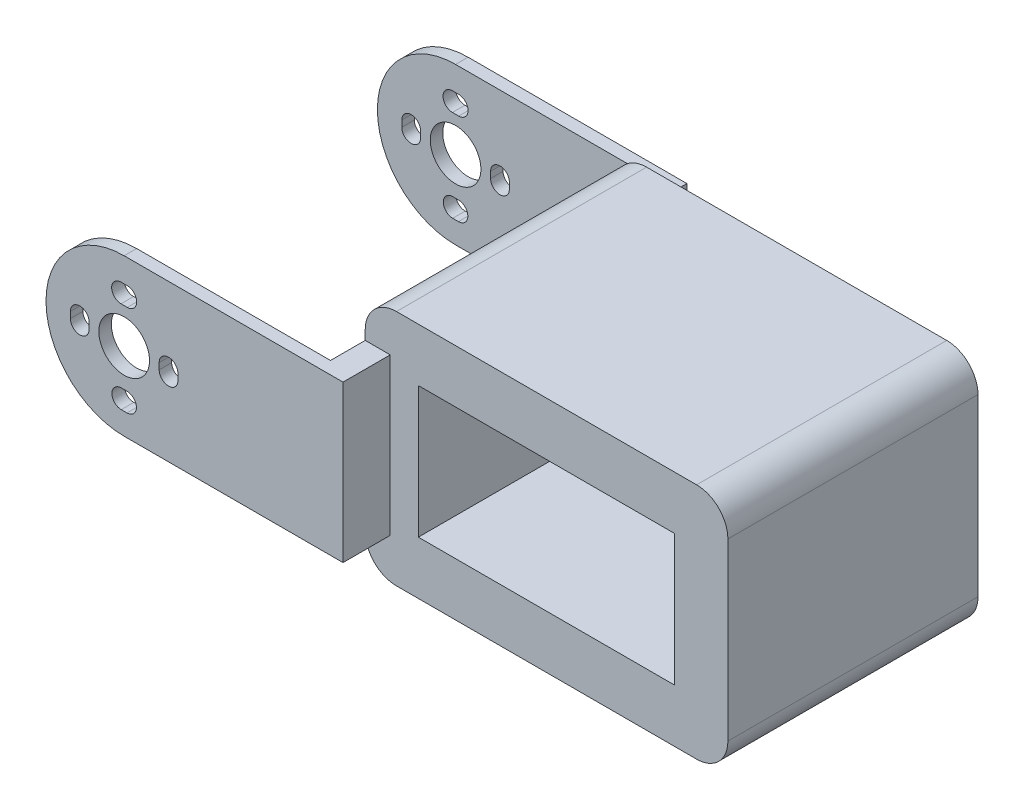
from build123d import *

# Parameters (mm, degrees)
SKETCH1_W           = 58
SKETCH1_H           = 38
SKETCH1_W_2         = 41
SKETCH1_H_2         = 21
BOSS_EXTRUDE1_DEPTH = 40
SKETCH2_W           = 4
SKETCH2_H           = 25
BOSS_EXTRUDE2_DEPTH = 5.55
SKETCH2_2_W         = 4
SKETCH2_2_H         = 25
BOSS_EXTRUDE3_DEPTH = 45.55
SKETCH3_R           = 4.05
BOSS_EXTRUDE6_DEPTH = 2
BOSS_EXTRUDE7_START = -53
SKETCH3_8_R         = 4.05
BOSS_EXTRUDE7_DEPTH = 53
CUT_EXTRUDE1_START  = -51
SKETCH3_11_R        = 4.05
CUT_EXTRUDE1_DEPTH  = 51
FILLET2_R           = 5
FILLET3_R           = 5
FILLET4_R           = 5
FILLET5_R           = 5


with BuildPart() as part:
    # Sketch1 → Boss-Extrude1 (new body)
    with BuildSketch(Plane.XY):
        with Locations((-0.095837804, -6.136072895)):
            Rectangle(SKETCH1_W, SKETCH1_H)
        with Locations((-0.095837804, -6.136072895)):
            Rectangle(SKETCH1_W_2, SKETCH1_H_2, mode=Mode.SUBTRACT)
    extrude(amount=BOSS_EXTRUDE1_DEPTH)

    # Sketch2 → Boss-Extrude2 (add)
    with BuildSketch(Plane.XY.offset(40)):
        with Locations((-27.095837804, -6.136072895)):
            Rectangle(SKETCH2_W, SKETCH2_H)
    extrude(amount=BOSS_EXTRUDE2_DEPTH)

    # Sketch2<2> → Boss-Extrude3 (add)
    with BuildSketch(Plane.XY.offset(40)):
        with Locations((-27.095837804, -6.136072895)):
            Rectangle(SKETCH2_2_W, SKETCH2_2_H)
    extrude(amount=-BOSS_EXTRUDE3_DEPTH)

    # Sketch3 → Boss-Extrude6 (add)
    with BuildSketch(Plane.XY.offset(45.55)):
        with BuildLine():
            Line((-25.095837804, -18.636072895), (-25.095837804, 6.363927105))
            Line((-25.095837804, 6.363927105), (-60.095837804, 6.363927105))
            ThreePointArc((-60.095837804, 6.363927105), (-72.595837804, -6.136072895), (-60.095837804, -18.636072895))
            Line((-60.095837804, -18.636072895), (-25.095837804, -18.636072895))
        make_face()
        with BuildLine():
            Line((-51.495837804, -5.636072895), (-51.495837804, -6.636072895))
            ThreePointArc((-51.495837804, -6.636072895), (-52.995837804, -8.136072895), (-54.495837804, -6.636072895))
            Line((-54.495837804, -6.636072895), (-54.495837804, -5.636072895))
            ThreePointArc((-54.495837804, -5.636072895), (-52.995837804, -4.136072895), (-51.495837804, -5.636072895))
        make_face(mode=Mode.SUBTRACT)
        with BuildLine():
            Line((-59.635749439, -15.176248856), (-60.555926168, -15.176248856))
            ThreePointArc((-60.555926168, -15.176248856), (-62.055926168, -13.676248856), (-60.555926168, -12.176248856))
            Line((-60.555926168, -12.176248856), (-59.635749439, -12.176248856))
            ThreePointArc((-59.635749439, -12.176248856), (-58.135749439, -13.676248856), (-59.635749439, -15.176248856))
        make_face(mode=Mode.SUBTRACT)
        with Locations((-60.095837804, -6.136072895)):
            Circle(SKETCH3_R, mode=Mode.SUBTRACT)
        with BuildLine():
            Line((-59.595837804, -0.536072895), (-60.595837804, -0.536072895))
            ThreePointArc((-60.595837804, -0.536072895), (-62.095837804, 0.963927105), (-60.595837804, 2.463927105))
            Line((-60.595837804, 2.463927105), (-59.595837804, 2.463927105))
            ThreePointArc((-59.595837804, 2.463927105), (-58.095837804, 0.963927105), (-59.595837804, -0.536072895))
        make_face(mode=Mode.SUBTRACT)
        with BuildLine():
            ThreePointArc((-68.695837804, -5.636072895), (-67.195837804, -4.136072895), (-65.695837804, -5.636072895))
            Line((-65.695837804, -5.636072895), (-65.695837804, -6.636072895))
            ThreePointArc((-65.695837804, -6.636072895), (-67.195837804, -8.136072895), (-68.695837804, -6.636072895))
            Line((-68.695837804, -6.636072895), (-68.695837804, -5.636072895))
        make_face(mode=Mode.SUBTRACT)
    extrude(amount=BOSS_EXTRUDE6_DEPTH)

    # Sketch3<8> → Boss-Extrude7 (add)
    with BuildSketch(Plane.XY.offset(45.55).offset(BOSS_EXTRUDE7_START)):
        with BuildLine():
            Line((-25.095837804, -18.636072895), (-25.095837804, 6.363927105))
            Line((-25.095837804, 6.363927105), (-60.095837804, 6.363927105))
            ThreePointArc((-60.095837804, 6.363927105), (-72.595837804, -6.136072895), (-60.095837804, -18.636072895))
            Line((-60.095837804, -18.636072895), (-25.095837804, -18.636072895))
        make_face()
        with BuildLine():
            Line((-51.495837804, -5.636072895), (-51.495837804, -6.636072895))
            ThreePointArc((-51.495837804, -6.636072895), (-52.995837804, -8.136072895), (-54.495837804, -6.636072895))
            Line((-54.495837804, -6.636072895), (-54.495837804, -5.636072895))
            ThreePointArc((-54.495837804, -5.636072895), (-52.995837804, -4.136072895), (-51.495837804, -5.636072895))
        make_face(mode=Mode.SUBTRACT)
        with BuildLine():
            Line((-59.635749439, -15.176248856), (-60.555926168, -15.176248856))
            ThreePointArc((-60.555926168, -15.176248856), (-62.055926168, -13.676248856), (-60.555926168, -12.176248856))
            Line((-60.555926168, -12.176248856), (-59.635749439, -12.176248856))
            ThreePointArc((-59.635749439, -12.176248856), (-58.135749439, -13.676248856), (-59.635749439, -15.176248856))
        make_face(mode=Mode.SUBTRACT)
        with Locations((-60.095837804, -6.136072895)):
            Circle(SKETCH3_8_R, mode=Mode.SUBTRACT)
        with BuildLine():
            Line((-59.595837804, -0.536072895), (-60.595837804, -0.536072895))
            ThreePointArc((-60.595837804, -0.536072895), (-62.095837804, 0.963927105), (-60.595837804, 2.463927105))
            Line((-60.595837804, 2.463927105), (-59.595837804, 2.463927105))
            ThreePointArc((-59.595837804, 2.463927105), (-58.095837804, 0.963927105), (-59.595837804, -0.536072895))
        make_face(mode=Mode.SUBTRACT)
        with BuildLine():
            ThreePointArc((-68.695837804, -5.636072895), (-67.195837804, -4.136072895), (-65.695837804, -5.636072895))
            Line((-65.695837804, -5.636072895), (-65.695837804, -6.636072895))
            ThreePointArc((-65.695837804, -6.636072895), (-67.195837804, -8.136072895), (-68.695837804, -6.636072895))
            Line((-68.695837804, -6.636072895), (-68.695837804, -5.636072895))
        make_face(mode=Mode.SUBTRACT)
    extrude(amount=BOSS_EXTRUDE7_DEPTH)

    # Sketch3<11> → Cut-Extrude1 (cut)
    with BuildSketch(Plane.XY.offset(45.55).offset(CUT_EXTRUDE1_START)):
        with BuildLine():
            Line((-29.095837804, -18.636072895), (-29.095837804, 6.363927105))
            Line((-29.095837804, 6.363927105), (-60.095837804, 6.363927105))
            ThreePointArc((-60.095837804, 6.363927105), (-72.595837804, -6.136072895), (-60.095837804, -18.636072895))
            Line((-60.095837804, -18.636072895), (-29.095837804, -18.636072895))
        make_face()
        with BuildLine():
            Line((-59.635749439, -15.176248856), (-60.555926168, -15.176248856))
            ThreePointArc((-60.555926168, -15.176248856), (-62.055926168, -13.676248856), (-60.555926168, -12.176248856))
            Line((-60.555926168, -12.176248856), (-59.635749439, -12.176248856))
            ThreePointArc((-59.635749439, -12.176248856), (-58.135749439, -13.676248856), (-59.635749439, -15.176248856))
        make_face(mode=Mode.SUBTRACT)
        with Locations((-60.095837804, -6.136072895)):
            Circle(SKETCH3_11_R, mode=Mode.SUBTRACT)
        with BuildLine():
            Line((-59.595837804, -0.536072895), (-60.595837804, -0.536072895))
            ThreePointArc((-60.595837804, -0.536072895), (-62.095837804, 0.963927105), (-60.595837804, 2.463927105))
            Line((-60.595837804, 2.463927105), (-59.595837804, 2.463927105))
            ThreePointArc((-59.595837804, 2.463927105), (-58.095837804, 0.963927105), (-59.595837804, -0.536072895))
        make_face(mode=Mode.SUBTRACT)
        with BuildLine():
            ThreePointArc((-54.495837804, -5.636072895), (-52.995837804, -4.136072895), (-51.495837804, -5.636072895))
            Line((-51.495837804, -5.636072895), (-51.495837804, -6.636072895))
            ThreePointArc((-51.495837804, -6.636072895), (-52.995837804, -8.136072895), (-54.495837804, -6.636072895))
            Line((-54.495837804, -6.636072895), (-54.495837804, -5.636072895))
        make_face(mode=Mode.SUBTRACT)
        with BuildLine():
            ThreePointArc((-68.695837804, -5.636072895), (-67.195837804, -4.136072895), (-65.695837804, -5.636072895))
            Line((-65.695837804, -5.636072895), (-65.695837804, -6.636072895))
            ThreePointArc((-65.695837804, -6.636072895), (-67.195837804, -8.136072895), (-68.695837804, -6.636072895))
            Line((-68.695837804, -6.636072895), (-68.695837804, -5.636072895))
        make_face(mode=Mode.SUBTRACT)
    extrude(amount=CUT_EXTRUDE1_DEPTH, mode=Mode.SUBTRACT)

    # Fillet2
    fillet2_edges = [part.edges().sort_by_distance(p)[0] for p in [
        (28.904162196, 12.863927105, 20),
    ]]
    fillet(fillet2_edges, radius=FILLET2_R)

    # Fillet3
    fillet3_edges = [part.edges().sort_by_distance(p)[0] for p in [
        (28.904162196, -25.136072895, 20),
    ]]
    fillet(fillet3_edges, radius=FILLET3_R)

    # Fillet4
    fillet4_edges = [part.edges().sort_by_distance(p)[0] for p in [
        (-29.095837804, 12.863927105, 20),
    ]]
    fillet(fillet4_edges, radius=FILLET4_R)

    # Fillet5
    fillet5_edges = [part.edges().sort_by_distance(p)[0] for p in [
        (-29.095837804, -25.136072895, 20),
    ]]
    fillet(fillet5_edges, radius=FILLET5_R)


solid = part.part
